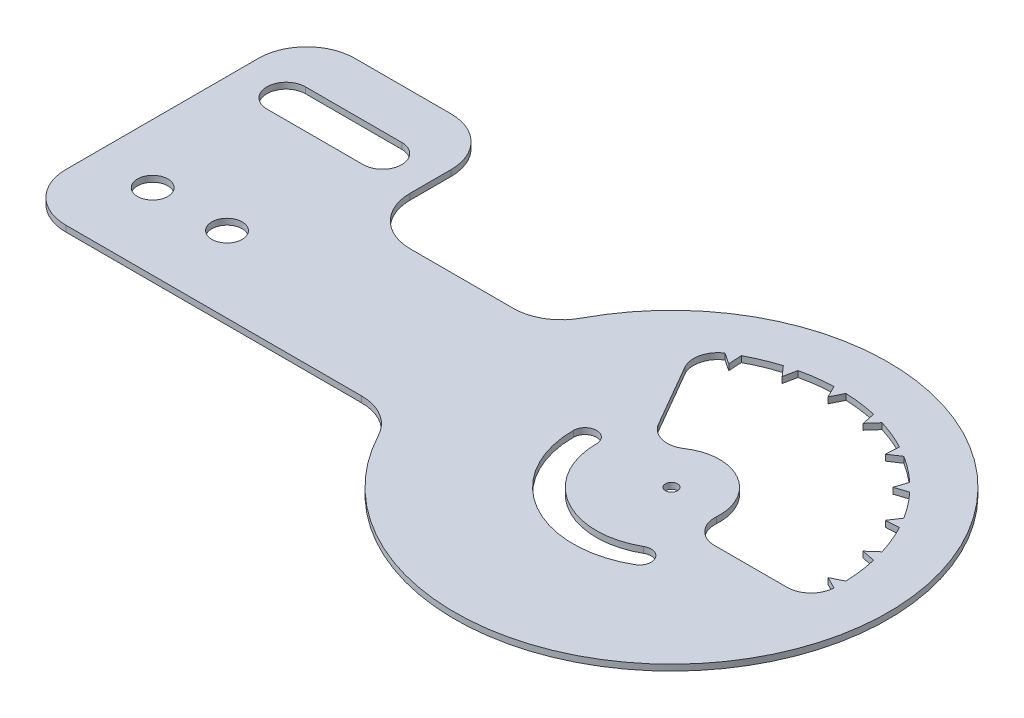
from build123d import *

# Parameters (mm, degrees)
SKETCH1_R                 = 1.27
SKETCH1_R_2               = 1.5875
BOSS_EXTRUDE1_DEPTH       = 1.5875
CUT_EXTRUDE3_DEPTH        = 163.771012948
CUT_EXTRUDE4_DEPTH        = 163.771012948
F_8_0MM_DOWEL_HOLE1_D     = 8
F_8_0MM_DOWEL_HOLE1_DEPTH = 5.08
F_8_0MM_DOWEL_HOLE1_TIP   = 2.403442476


with BuildPart() as part:
    # Sketch1 → Boss-Extrude1 (new body)
    with BuildSketch(Plane(origin=(0, 0, 0), x_dir=(1, 0, 0), z_dir=(0, 1, 0))):
        with BuildLine():
            Line((-152.4, 43.5), (-152.4, -7.3))
            ThreePointArc((-152.4, -7.3), (-148.680256121, -16.280256121), (-139.7, -20))
            Line((-139.7, -20), (-61.723030548, -20))
            ThreePointArc((-61.723030548, -20), (-55.173880707, -21.818886254), (-50.500661357, -26.754545455))
            ThreePointArc((-50.500661357, -26.754545455), (57.15, 0), (-50.500661357, 26.754545455))
            ThreePointArc((-50.500661357, 26.754545455), (-55.173880707, 21.818886254), (-61.723030548, 20))
            Line((-61.723030548, 20), (-88.9, 20))
            ThreePointArc((-88.9, 20), (-97.880256121, 23.719743879), (-101.6, 32.7))
            Line((-101.6, 32.7), (-101.6, 43.5))
            ThreePointArc((-101.6, 43.5), (-105.319743879, 52.480256121), (-114.3, 56.2))
            Line((-114.3, 56.2), (-139.7, 56.2))
            ThreePointArc((-139.7, 56.2), (-148.680256121, 52.480256121), (-152.4, 43.5))
        make_face()
        with Locations(Location((-136.8, 0, 0), (0, 0, 270))):
            Circle(SKETCH1_R, mode=Mode.SUBTRACT)
        with Locations(Location((-117.2, 0, 0), (0, 0, 270))):
            Circle(SKETCH1_R, mode=Mode.SUBTRACT)
        with Locations(Location((0, 0, 0), (0, 0, 270))):
            Circle(SKETCH1_R_2, mode=Mode.SUBTRACT)
        with BuildLine():
            Line((-139.7, 33.02), (-114.3, 33.02))
            ThreePointArc((-114.3, 33.02), (-109.22, 38.1), (-114.3, 43.18))
            Line((-114.3, 43.18), (-139.7, 43.18))
            ThreePointArc((-139.7, 43.18), (-144.78, 38.1), (-139.7, 33.02))
        make_face(mode=Mode.SUBTRACT)
    extrude(amount=BOSS_EXTRUDE1_DEPTH)

    # Sketch5 → Cut-Extrude3 (cut, through all)
    with BuildSketch(Plane.XZ):
        with BuildLine():
            ThreePointArc((-19.811942673, -0.047660352), (-9.947246413, 17.133815477), (9.864696261, 17.18147583))
            ThreePointArc((9.864696261, 17.18147583), (14.025645813, 18.307134225), (12.899987418, 22.468083777))
            ThreePointArc((12.899987418, 22.468083777), (-13.007937617, 22.405758701), (-25.907925034, -0.062325076))
            ThreePointArc((-25.907925034, -0.062325076), (-22.852601492, -3.102983895), (-19.811942673, -0.047660352))
        make_face()
    extrude(amount=-CUT_EXTRUDE3_DEPTH, mode=Mode.SUBTRACT)

    # Sketch6 → Cut-Extrude4 (cut, through all)
    with BuildSketch(Plane.XZ):
        with BuildLine():
            Line((-16.102923339, -12.651081374), (-25.638527302, -29.167231918))
            ThreePointArc((-25.638527302, -29.167231918), (-26.310404552, -33.838744139), (-23.573299486, -37.683572006))
            Line((-23.573299486, -37.683572006), (-20.6375, -35.745198541))
            Line((-20.6375, -35.745198541), (-20.848318298, -39.257484944))
            ThreePointArc((-20.848318298, -39.257484944), (-17.010278569, -41.06644522), (-13.017246571, -42.501221061))
            Line((-13.017246571, -42.501221061), (-10.682756087, -39.86858848))
            Line((-10.682756087, -39.86858848), (-9.977344313, -43.315760417))
            ThreePointArc((-9.977344313, -43.315760417), (-5.801889244, -44.069724088), (-1.5735692, -44.422138399))
            Line((-1.5735692, -44.422138399), (0, -41.275))
            Line((0, -41.275), (1.5735692, -44.422138399))
            ThreePointArc((1.5735692, -44.422138399), (5.801889244, -44.069724088), (9.977344313, -43.315760417))
            Line((9.977344313, -43.315760417), (10.682756087, -39.86858848))
            Line((10.682756087, -39.86858848), (13.017246571, -42.501221061))
            ThreePointArc((13.017246571, -42.501221061), (17.010278569, -41.06644522), (20.848318298, -39.257484944))
            Line((20.848318298, -39.257484944), (20.6375, -35.745198541))
            Line((20.6375, -35.745198541), (23.573820101, -37.683915744))
            ThreePointArc((23.573820101, -37.683915744), (27.059445519, -35.264555976), (30.298513845, -32.523876749))
            Line((30.298513845, -32.523876749), (29.185832393, -29.185832393))
            Line((29.185832393, -29.185832393), (32.523876749, -30.298513845))
            ThreePointArc((32.523876749, -30.298513845), (35.264555976, -27.059445519), (37.683915744, -23.573820101))
            Line((37.683915744, -23.573820101), (35.745198541, -20.6375))
            Line((35.745198541, -20.6375), (39.257484944, -20.848318298))
            ThreePointArc((39.257484944, -20.848318298), (41.06644522, -17.010278569), (42.501221061, -13.017246571))
            Line((42.501221061, -13.017246571), (39.86858848, -10.682756087))
            Line((39.86858848, -10.682756087), (43.315760417, -9.977344313))
            ThreePointArc((43.315760417, -9.977344313), (44.069724088, -5.801889244), (44.422138399, -1.5735692))
            Line((44.422138399, -1.5735692), (41.275, 0))
            Line((41.275, 0), (44.421580406, 1.573290203))
            ThreePointArc((44.421580406, 1.573290203), (42.460414333, 5.866106656), (38.07882745, 7.62))
            Line((38.07882745, 7.62), (19.007619525, 7.62))
            ThreePointArc((19.007619525, 7.62), (14.370235205, 5.607875824), (12.67174635, 0.846666667))
            ThreePointArc((12.67174635, 0.846666667), (6.35, -10.998522628), (-7.069108017, -10.550720916))
            ThreePointArc((-7.069108017, -10.550720916), (-12.041680527, -9.641050833), (-16.102923339, -12.651081374))
        make_face()
    extrude(amount=-CUT_EXTRUDE4_DEPTH, mode=Mode.SUBTRACT)

    # Ø8.0mm Dowel Hole1
    with Locations(Plane(origin=(0, 1.5875, 0), x_dir=(1, 0, 0), z_dir=(0, 1, 0))):
        with Locations((-136.8, 0), (-117.2, 0)):
            Hole(F_8_0MM_DOWEL_HOLE1_D / 2, depth=F_8_0MM_DOWEL_HOLE1_DEPTH)
            with Locations((0, 0, -(F_8_0MM_DOWEL_HOLE1_DEPTH + F_8_0MM_DOWEL_HOLE1_TIP / 2))):  # 118° drill point
                Cone(0, F_8_0MM_DOWEL_HOLE1_D / 2, F_8_0MM_DOWEL_HOLE1_TIP, mode=Mode.SUBTRACT)


solid = part.part
